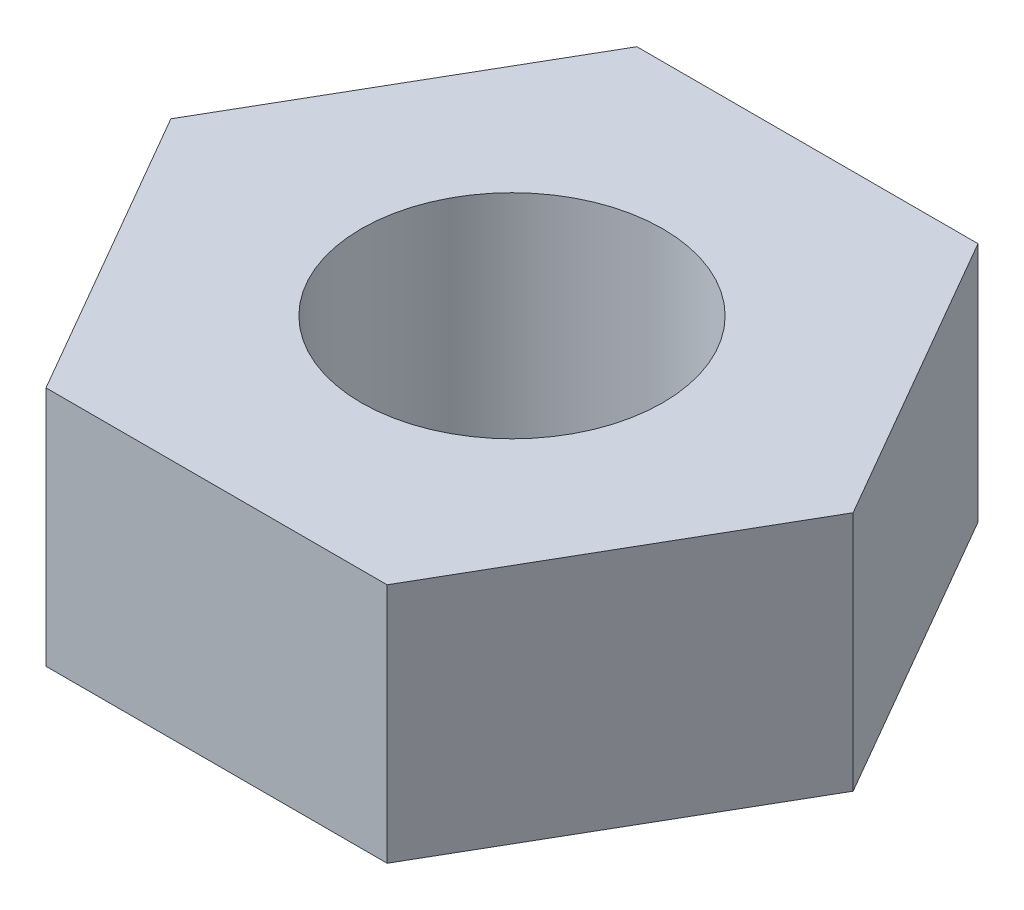
from build123d import *

# Parameters (mm, degrees)
SKETCH1_R           = 1.25
BOSS_EXTRUDE1_DEPTH = 2


with BuildPart() as part:
    # Sketch1 → Boss-Extrude1 (new body)
    with BuildSketch(Plane(origin=(0, 0, 0), x_dir=(1, 0, 0), z_dir=(0, 1, 0))):
        Polygon((1.41450816, 2.45), (-1.41450816, 2.45), (-2.829016319, 0), (-1.41450816, -2.45), (1.41450816, -2.45), (2.829016319, 0), align=None)
        with Locations(Location((0, 0, 0), (0, 0, 270))):
            Circle(SKETCH1_R, mode=Mode.SUBTRACT)
    extrude(amount=BOSS_EXTRUDE1_DEPTH)


solid = part.part
